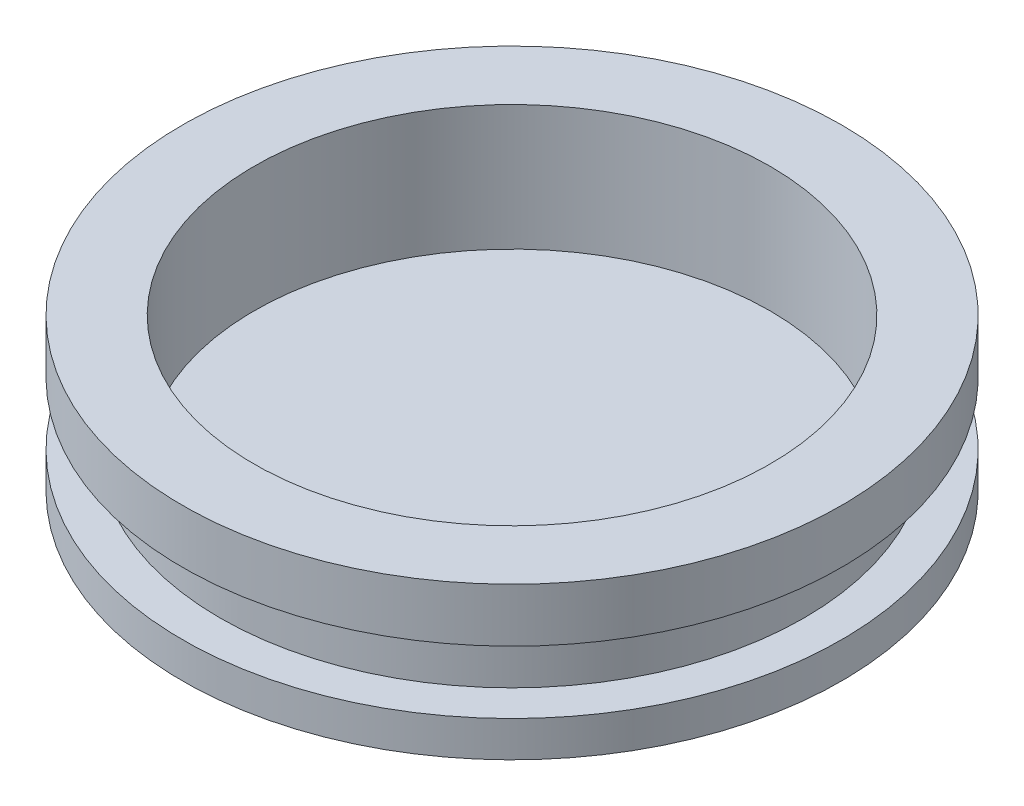
from build123d import *


with BuildPart() as part:
    # Esboço1 → Revolução1 (revolve)
    with BuildSketch(Plane.XY, mode=Mode.PRIVATE) as revolu_o1_sk:
        Polygon((0, -1.5), (0, 0), (-14.42, 0), (-14.42, 7), (-18.42, 7), (-18.42, 4), (-16.32, 4), (-16.32, 0.5), (-18.42, 0.5), (-18.42, -1.5), align=None)
    revolve(revolu_o1_sk.sketch.rotate(Axis((0, -1.5, 0), (0, 1, 0)), 270), axis=Axis((0, -1.5, 0), (0, 1, 0)))


solid = part.part
